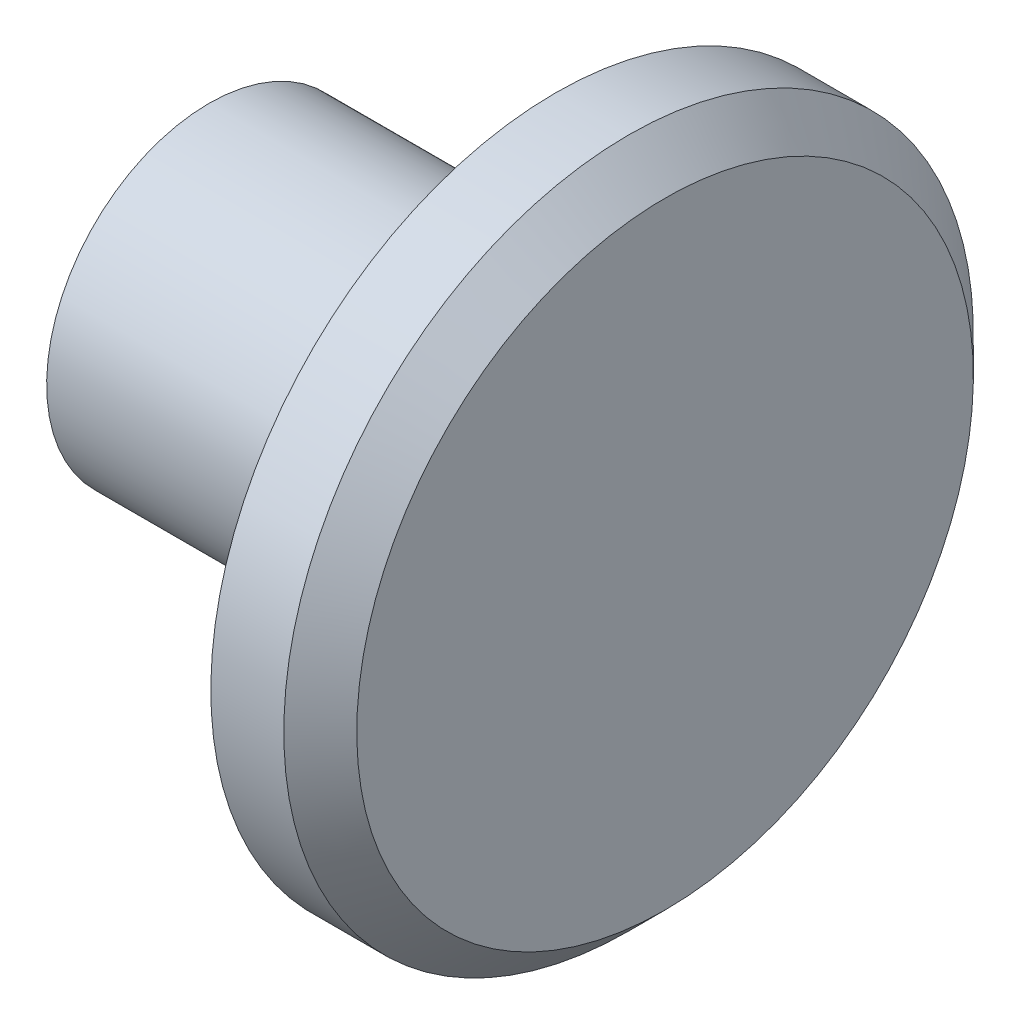
from build123d import *

# Parameters (mm, degrees)
CHAMFER1_SIZE = 1


with BuildPart() as part:
    # Sketch1 → Revolve1 (revolve)
    with BuildSketch(Plane.XY, mode=Mode.PRIVATE) as revolve1_sk:
        Polygon((-6.25, -4.45), (3.25, -4.45), (3.25, -9.45), (6.25, -9.45), (6.25, 0), (-6.25, 0), align=None)
    revolve(revolve1_sk.sketch.rotate(Axis((6.25, 0, 0), (-1, 0, 0)), 180), axis=Axis((6.25, 0, 0), (-1, 0, 0)))

    # Chamfer1
    chamfer1_edges = [part.edges().sort_by_distance(p)[0] for p in [
        (6.25, -9.45, 0),
    ]]
    chamfer(chamfer1_edges, length=CHAMFER1_SIZE)


solid = part.part
